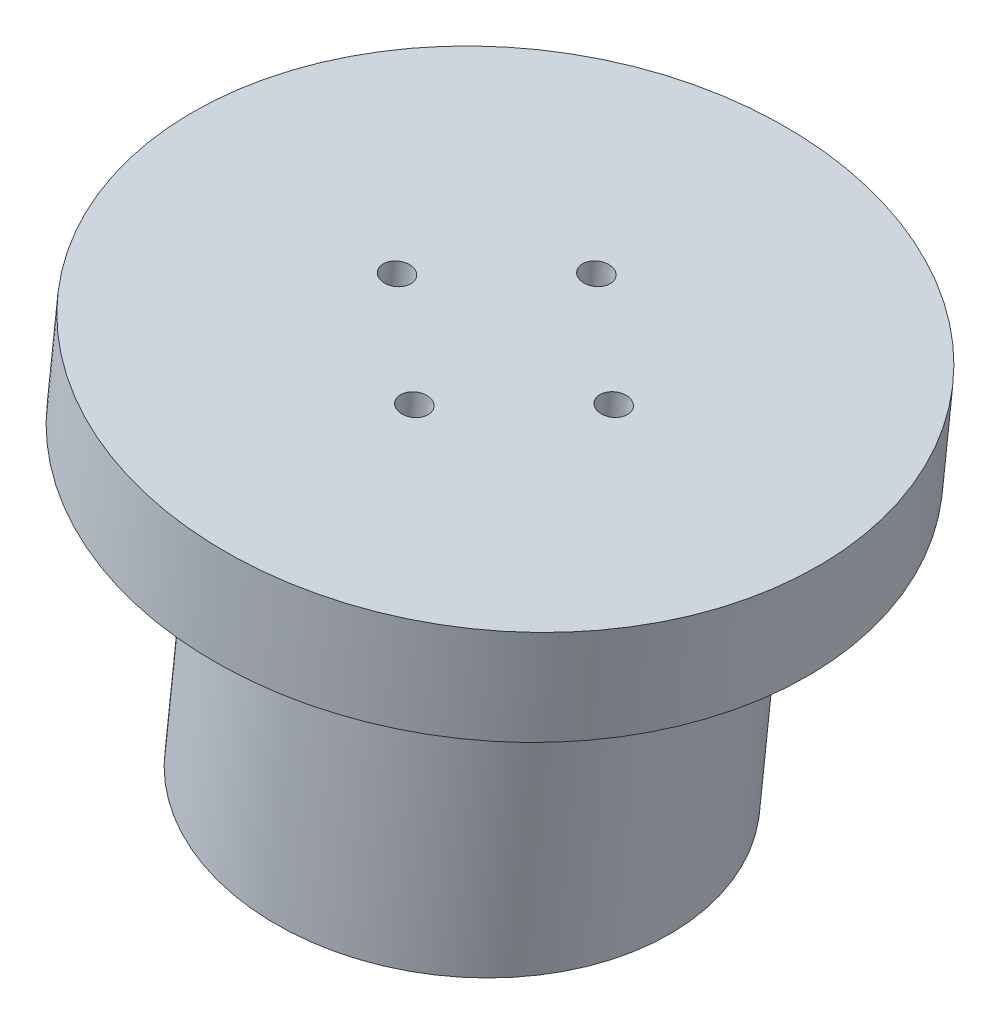
from build123d import *

# Parameters (mm, degrees)
BOSS_EXTRUDE2_DEPTH      = 12
BOSS_EXTRUDE2_DEPTH_BACK = 18.35
SKETCH3_R                = 20.599499999
CUT_EXTRUDE2_DEPTH       = 10
SKETCH5_R                = 30.999999999
BOSS_EXTRUDE3_DEPTH      = 10
CUT_EXTRUDE3_REACH       = 100.809
SKETCH7_R                = 1.365


with BuildPart() as part:
    # Sketch3 → Boss-Extrude2 (new, two sides: drawn at the far end of the back side and taken through both)
    with BuildSketch(Plane(origin=(53.132442303, 452.346775715, 5.622561963), x_dir=(0.9931732430561937, -0.11663964741431751, -0.0014498028509745849), z_dir=(-0.11664865741723304, -0.9930965298387961, -0.012343951753720052)).offset(-BOSS_EXTRUDE2_DEPTH_BACK)):
        with Locations(Location((-41.42738807, 23.530711727, 0), (0, 0, 180.083073943))):
            Circle(SKETCH3_R)
    extrude(amount=BOSS_EXTRUDE2_DEPTH + BOSS_EXTRUDE2_DEPTH_BACK)

    # Sketch4 → Cut-Extrude2 (cut)
    with BuildSketch(Plane(origin=(51.732658414, 440.429617357, 5.474434542), x_dir=(0.9931732430561937, -0.1166396474143174, -0.001449802850974575), z_dir=(-0.11664865741723293, -0.9930965298387961, -0.012343951753719985))):
        with BuildLine():
            Line((-38.551989149, 22.67509438), (-41.097444518, 20.548910719))
            ThreePointArc((-41.097444518, 20.548910719), (-44.186998686, 22.354043021), (-43.350593551, 25.833162742))
            ThreePointArc((-43.350593551, 25.833162742), (-39.778140656, 26.036701146), (-38.551989149, 22.67509438))
        make_face()
    extrude(amount=-CUT_EXTRUDE2_DEPTH, mode=Mode.SUBTRACT)

    # Sketch5 → Boss-Extrude3 (add)
    with BuildSketch(Plane(origin=(55.272945167, 470.570097038, 5.849073478), x_dir=(0.9931732430561937, -0.11663964741431687, -0.0014498028509745493), z_dir=(0.11664865741723239, 0.9930965298387961, 0.012343951753719856))):
        with Locations(Location((-41.42738807, -23.530711727, 0), (0, 0, 359.916926057))):
            Circle(SKETCH5_R)
    extrude(amount=BOSS_EXTRUDE3_DEPTH)

    # Sketch7 → Cut-Extrude3 (cut, up to next)
    with BuildSketch(Plane(origin=(56.439431742, 480.501062336, 5.972512996), x_dir=(0.9931732430561937, -0.11663964741431691, -0.0014498028509745543), z_dir=(0.11664865741723243, 0.9930965298387961, 0.012343951753719861)), mode=Mode.PRIVATE) as cut_extrude3_sk1:
        with Locations(Location((-40.55325276, -33.270564316, 0), (0, 0, 179.916926057))):
            Circle(SKETCH7_R)
    cut_extrude3_tool1 = extrude(cut_extrude3_sk1.sketch, amount=-CUT_EXTRUDE3_REACH, mode=Mode.PRIVATE) & part.part
    # Sketch7 → Cut-Extrude3 (cut, up to next)
    with BuildSketch(Plane(origin=(56.439431742, 480.501062336, 5.972512996), x_dir=(0.9931732430561937, -0.11663964741431691, -0.0014498028509745543), z_dir=(0.11664865741723243, 0.9930965298387961, 0.012343951753719861)), mode=Mode.PRIVATE) as cut_extrude3_sk2:
        with Locations(Location((-51.16724066, -24.404847037, 0), (0, 0, 179.916926057))):
            Circle(SKETCH7_R)
    cut_extrude3_tool2 = extrude(cut_extrude3_sk2.sketch, amount=-CUT_EXTRUDE3_REACH, mode=Mode.PRIVATE) & part.part
    # Sketch7 → Cut-Extrude3 (cut, up to next)
    with BuildSketch(Plane(origin=(56.439431742, 480.501062336, 5.972512996), x_dir=(0.9931732430561937, -0.11663964741431691, -0.0014498028509745543), z_dir=(0.11664865741723243, 0.9930965298387961, 0.012343951753719861)), mode=Mode.PRIVATE) as cut_extrude3_sk3:
        with Locations(Location((-42.301523381, -13.790859137, 0), (0, 0, 179.916926057))):
            Circle(SKETCH7_R)
    cut_extrude3_tool3 = extrude(cut_extrude3_sk3.sketch, amount=-CUT_EXTRUDE3_REACH, mode=Mode.PRIVATE) & part.part
    # Sketch7 → Cut-Extrude3 (cut, up to next)
    with BuildSketch(Plane(origin=(56.439431742, 480.501062336, 5.972512996), x_dir=(0.9931732430561937, -0.11663964741431691, -0.0014498028509745543), z_dir=(0.11664865741723243, 0.9930965298387961, 0.012343951753719861)), mode=Mode.PRIVATE) as cut_extrude3_sk4:
        with Locations(Location((-31.687535481, -22.656576416, 0), (0, 0, 179.916926057))):
            Circle(SKETCH7_R)
    cut_extrude3_tool4 = extrude(cut_extrude3_sk4.sketch, amount=-CUT_EXTRUDE3_REACH, mode=Mode.PRIVATE) & part.part
    add(cut_extrude3_tool1.solids().sort_by_distance((16.163026, 484.817666, 39.299302))[0], mode=Mode.SUBTRACT)
    add(cut_extrude3_tool2.solids().sort_by_distance((5.621497, 486.165868, 30.449657))[0], mode=Mode.SUBTRACT)
    add(cut_extrude3_tool3.solids().sort_by_distance((14.426691, 485.263693, 19.823636))[0], mode=Mode.SUBTRACT)
    add(cut_extrude3_tool4.solids().sort_by_distance((24.968219, 483.915491, 28.67328))[0], mode=Mode.SUBTRACT)


solid = part.part
